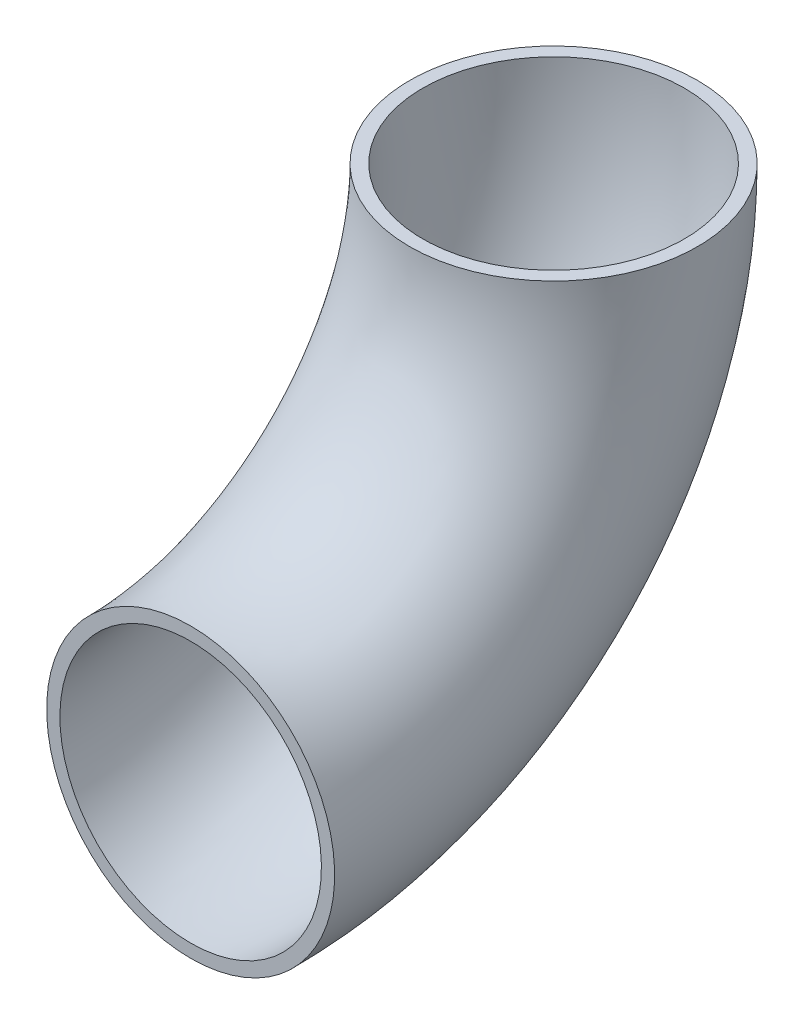
from build123d import *

# Parameters (mm, degrees)
IZIM2_R   = 30.15
IZIM2_R_2 = 27.38


with BuildPart() as part:
    # Süpür1: sweep along a path in Çizim1
    with BuildLine(Plane(origin=(0, 0, 0), x_dir=(0, 0, -1), z_dir=(1, 0, 0))) as s_p_r1_path:
        ThreePointArc((0, 0), (53.74011537, 22.25988463), (76, 76))
    # Çizim2 → Süpür1 (sweep)
    with BuildSketch(Plane.XY):
        Circle(IZIM2_R)
        Circle(IZIM2_R_2, mode=Mode.SUBTRACT)
    sweep(path=s_p_r1_path.line)


solid = part.part
